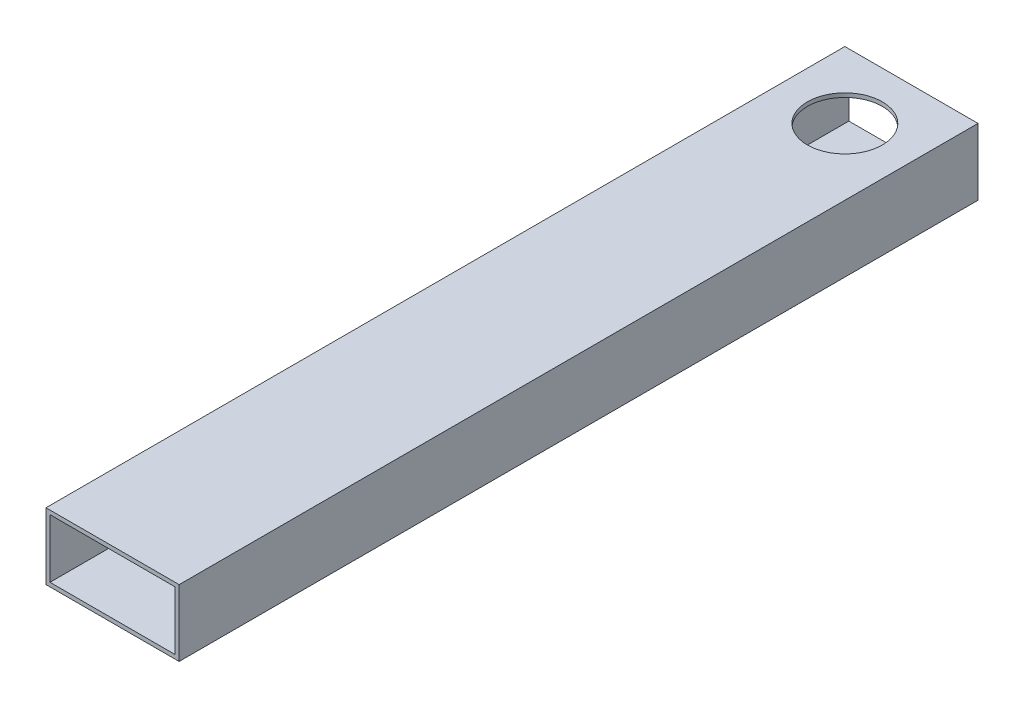
from build123d import *

# Parameters (mm, degrees)
SKETCH1_W           = 50.8
SKETCH1_H           = 25.4
SKETCH1_W_2         = 47.752
SKETCH1_H_2         = 22.352
EXTRUDE_THIN1_DEPTH = 304.8
SKETCH2_R           = 14.2875
CUT_EXTRUDE2_DEPTH  = 25.4


with BuildPart() as part:
    # Sketch1 → Extrude-Thin1 (new body)
    with BuildSketch(Plane.XY):
        with Locations((-25.4, -12.7)):
            Rectangle(SKETCH1_W, SKETCH1_H)
        with Locations((-25.4, -12.7)):
            Rectangle(SKETCH1_W_2, SKETCH1_H_2, mode=Mode.SUBTRACT)
    extrude(amount=EXTRUDE_THIN1_DEPTH)

    # Sketch2 → Cut-Extrude2 (cut)
    with BuildSketch(Plane(origin=(0, 0, 0), x_dir=(1, 0, 0), z_dir=(0, 1, 0))):
        with Locations(Location((-25.4, -25.4, 0), (0, 0, 270))):
            Circle(SKETCH2_R)
    extrude(amount=-CUT_EXTRUDE2_DEPTH, mode=Mode.SUBTRACT)


solid = part.part
